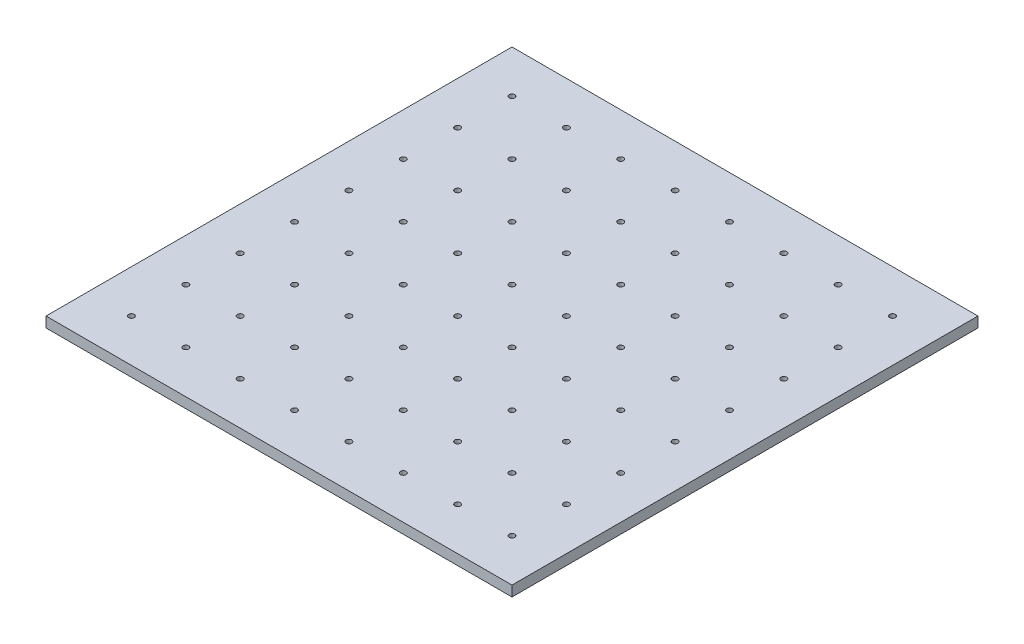
from build123d import *

# Parameters (mm, degrees)
SKETCH_1_W      = 180
SKETCH_1_H      = 180
SKETCH_1_R      = 1.1
EXTRUDE_1_DEPTH = 4


with BuildPart() as part:
    # ｽｹｯﾁ1 → ﾎﾞｽ - 押し出し1 (new body)
    with BuildSketch(Plane(origin=(0, 0, 0), x_dir=(1, 0, 0), z_dir=(0, 1, 0))):
        Rectangle(SKETCH_1_W, SKETCH_1_H)
        with Locations(Location((-73.5, 52.5, 0), (0, 0, 270))):
            Circle(SKETCH_1_R, mode=Mode.SUBTRACT)
        with Locations(Location((-73.5, 73.5, 0), (0, 0, 270))):
            Circle(SKETCH_1_R, mode=Mode.SUBTRACT)
        with Locations(Location((-52.5, 73.5, 0), (0, 0, 270))):
            Circle(SKETCH_1_R, mode=Mode.SUBTRACT)
        with Locations(Location((-52.5, 52.5, 0), (0, 0, 270))):
            Circle(SKETCH_1_R, mode=Mode.SUBTRACT)
        with Locations(Location((-31.5, 52.5, 0), (0, 0, 270))):
            Circle(SKETCH_1_R, mode=Mode.SUBTRACT)
        with Locations(Location((-31.5, 73.5, 0), (0, 0, 270))):
            Circle(SKETCH_1_R, mode=Mode.SUBTRACT)
        with Locations(Location((-10.5, 73.5, 0), (0, 0, 270))):
            Circle(SKETCH_1_R, mode=Mode.SUBTRACT)
        with Locations(Location((-10.5, 52.5, 0), (0, 0, 270))):
            Circle(SKETCH_1_R, mode=Mode.SUBTRACT)
        with Locations(Location((10.5, 52.5, 0), (0, 0, 270))):
            Circle(SKETCH_1_R, mode=Mode.SUBTRACT)
        with Locations(Location((10.5, 73.5, 0), (0, 0, 270))):
            Circle(SKETCH_1_R, mode=Mode.SUBTRACT)
        with Locations(Location((31.5, 73.5, 0), (0, 0, 270))):
            Circle(SKETCH_1_R, mode=Mode.SUBTRACT)
        with Locations(Location((31.5, 52.5, 0), (0, 0, 270))):
            Circle(SKETCH_1_R, mode=Mode.SUBTRACT)
        with Locations(Location((52.5, 52.5, 0), (0, 0, 270))):
            Circle(SKETCH_1_R, mode=Mode.SUBTRACT)
        with Locations(Location((52.5, 73.5, 0), (0, 0, 270))):
            Circle(SKETCH_1_R, mode=Mode.SUBTRACT)
        with Locations(Location((73.5, 73.5, 0), (0, 0, 270))):
            Circle(SKETCH_1_R, mode=Mode.SUBTRACT)
        with Locations(Location((73.5, 52.5, 0), (0, 0, 270))):
            Circle(SKETCH_1_R, mode=Mode.SUBTRACT)
        with Locations(Location((-31.5, 10.5, 0), (0, 0, 270))):
            Circle(SKETCH_1_R, mode=Mode.SUBTRACT)
        with Locations(Location((-31.5, 31.5, 0), (0, 0, 270))):
            Circle(SKETCH_1_R, mode=Mode.SUBTRACT)
        with Locations(Location((-10.5, 31.5, 0), (0, 0, 270))):
            Circle(SKETCH_1_R, mode=Mode.SUBTRACT)
        with Locations(Location((-10.5, 10.5, 0), (0, 0, 270))):
            Circle(SKETCH_1_R, mode=Mode.SUBTRACT)
        with Locations(Location((10.5, 10.5, 0), (0, 0, 270))):
            Circle(SKETCH_1_R, mode=Mode.SUBTRACT)
        with Locations(Location((10.5, 31.5, 0), (0, 0, 270))):
            Circle(SKETCH_1_R, mode=Mode.SUBTRACT)
        with Locations(Location((31.5, 31.5, 0), (0, 0, 270))):
            Circle(SKETCH_1_R, mode=Mode.SUBTRACT)
        with Locations(Location((31.5, 10.5, 0), (0, 0, 270))):
            Circle(SKETCH_1_R, mode=Mode.SUBTRACT)
        with Locations(Location((52.5, 10.5, 0), (0, 0, 270))):
            Circle(SKETCH_1_R, mode=Mode.SUBTRACT)
        with Locations(Location((52.5, 31.5, 0), (0, 0, 270))):
            Circle(SKETCH_1_R, mode=Mode.SUBTRACT)
        with Locations(Location((73.5, 31.5, 0), (0, 0, 270))):
            Circle(SKETCH_1_R, mode=Mode.SUBTRACT)
        with Locations(Location((73.5, 10.5, 0), (0, 0, 270))):
            Circle(SKETCH_1_R, mode=Mode.SUBTRACT)
        with Locations(Location((-31.5, -31.5, 0), (0, 0, 270))):
            Circle(SKETCH_1_R, mode=Mode.SUBTRACT)
        with Locations(Location((-31.5, -10.5, 0), (0, 0, 270))):
            Circle(SKETCH_1_R, mode=Mode.SUBTRACT)
        with Locations(Location((-10.5, -10.5, 0), (0, 0, 270))):
            Circle(SKETCH_1_R, mode=Mode.SUBTRACT)
        with Locations(Location((-10.5, -31.5, 0), (0, 0, 270))):
            Circle(SKETCH_1_R, mode=Mode.SUBTRACT)
        with Locations(Location((10.5, -31.5, 0), (0, 0, 270))):
            Circle(SKETCH_1_R, mode=Mode.SUBTRACT)
        with Locations(Location((10.5, -10.5, 0), (0, 0, 270))):
            Circle(SKETCH_1_R, mode=Mode.SUBTRACT)
        with Locations(Location((31.5, -10.5, 0), (0, 0, 270))):
            Circle(SKETCH_1_R, mode=Mode.SUBTRACT)
        with Locations(Location((31.5, -31.5, 0), (0, 0, 270))):
            Circle(SKETCH_1_R, mode=Mode.SUBTRACT)
        with Locations(Location((52.5, -31.5, 0), (0, 0, 270))):
            Circle(SKETCH_1_R, mode=Mode.SUBTRACT)
        with Locations(Location((52.5, -10.5, 0), (0, 0, 270))):
            Circle(SKETCH_1_R, mode=Mode.SUBTRACT)
        with Locations(Location((73.5, -10.5, 0), (0, 0, 270))):
            Circle(SKETCH_1_R, mode=Mode.SUBTRACT)
        with Locations(Location((73.5, -31.5, 0), (0, 0, 270))):
            Circle(SKETCH_1_R, mode=Mode.SUBTRACT)
        with Locations(Location((-31.5, -73.5, 0), (0, 0, 270))):
            Circle(SKETCH_1_R, mode=Mode.SUBTRACT)
        with Locations(Location((-31.5, -52.5, 0), (0, 0, 270))):
            Circle(SKETCH_1_R, mode=Mode.SUBTRACT)
        with Locations(Location((-10.5, -52.5, 0), (0, 0, 270))):
            Circle(SKETCH_1_R, mode=Mode.SUBTRACT)
        with Locations(Location((-10.5, -73.5, 0), (0, 0, 270))):
            Circle(SKETCH_1_R, mode=Mode.SUBTRACT)
        with Locations(Location((10.5, -73.5, 0), (0, 0, 270))):
            Circle(SKETCH_1_R, mode=Mode.SUBTRACT)
        with Locations(Location((10.5, -52.5, 0), (0, 0, 270))):
            Circle(SKETCH_1_R, mode=Mode.SUBTRACT)
        with Locations(Location((31.5, -52.5, 0), (0, 0, 270))):
            Circle(SKETCH_1_R, mode=Mode.SUBTRACT)
        with Locations(Location((31.5, -73.5, 0), (0, 0, 270))):
            Circle(SKETCH_1_R, mode=Mode.SUBTRACT)
        with Locations(Location((52.5, -73.5, 0), (0, 0, 270))):
            Circle(SKETCH_1_R, mode=Mode.SUBTRACT)
        with Locations(Location((52.5, -52.5, 0), (0, 0, 270))):
            Circle(SKETCH_1_R, mode=Mode.SUBTRACT)
        with Locations(Location((73.5, -52.5, 0), (0, 0, 270))):
            Circle(SKETCH_1_R, mode=Mode.SUBTRACT)
        with Locations(Location((73.5, -73.5, 0), (0, 0, 270))):
            Circle(SKETCH_1_R, mode=Mode.SUBTRACT)
        with Locations(Location((-73.5, 10.5, 0), (0, 0, 270))):
            Circle(SKETCH_1_R, mode=Mode.SUBTRACT)
        with Locations(Location((-73.5, 31.5, 0), (0, 0, 270))):
            Circle(SKETCH_1_R, mode=Mode.SUBTRACT)
        with Locations(Location((-52.5, 31.5, 0), (0, 0, 270))):
            Circle(SKETCH_1_R, mode=Mode.SUBTRACT)
        with Locations(Location((-52.5, 10.5, 0), (0, 0, 270))):
            Circle(SKETCH_1_R, mode=Mode.SUBTRACT)
        with Locations(Location((-73.5, -31.5, 0), (0, 0, 270))):
            Circle(SKETCH_1_R, mode=Mode.SUBTRACT)
        with Locations(Location((-73.5, -10.5, 0), (0, 0, 270))):
            Circle(SKETCH_1_R, mode=Mode.SUBTRACT)
        with Locations(Location((-52.5, -10.5, 0), (0, 0, 270))):
            Circle(SKETCH_1_R, mode=Mode.SUBTRACT)
        with Locations(Location((-52.5, -31.5, 0), (0, 0, 270))):
            Circle(SKETCH_1_R, mode=Mode.SUBTRACT)
        with Locations(Location((-73.5, -73.5, 0), (0, 0, 270))):
            Circle(SKETCH_1_R, mode=Mode.SUBTRACT)
        with Locations(Location((-73.5, -52.5, 0), (0, 0, 270))):
            Circle(SKETCH_1_R, mode=Mode.SUBTRACT)
        with Locations(Location((-52.5, -52.5, 0), (0, 0, 270))):
            Circle(SKETCH_1_R, mode=Mode.SUBTRACT)
        with Locations(Location((-52.5, -73.5, 0), (0, 0, 270))):
            Circle(SKETCH_1_R, mode=Mode.SUBTRACT)
    extrude(amount=EXTRUDE_1_DEPTH)


solid = part.part
